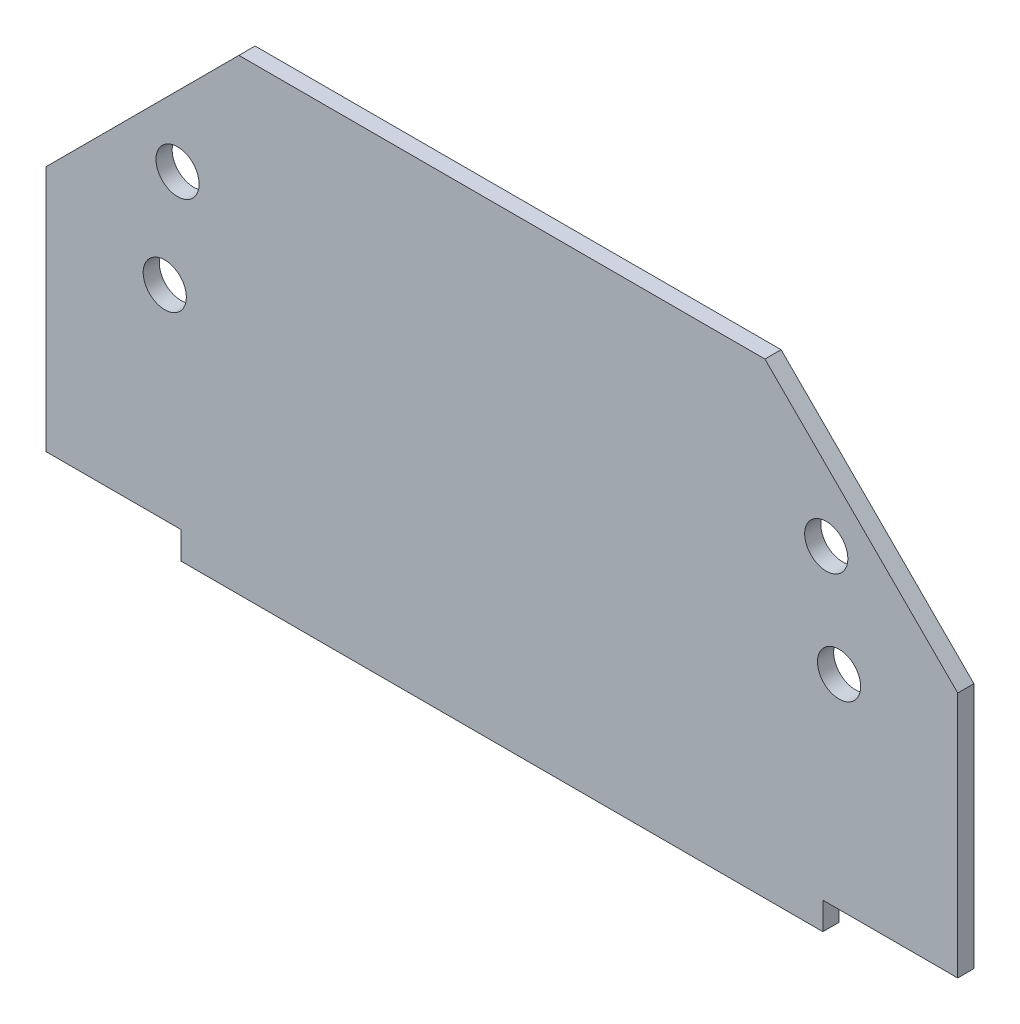
from build123d import *

# Parameters (mm, degrees)
SKETCH1_R           = 1.6
BOSS_EXTRUDE1_DEPTH = 1.2


with BuildPart() as part:
    # Sketch1 → Boss-Extrude1 (new body)
    with BuildSketch(Plane.XY):
        Polygon((-33.8, 12.786782193), (-33.8, 31.089725919), (-19.502943725, 45.386782193), (19.502943725, 45.386782193), (33.8, 31.089725919), (33.8, 12.786782193), (23.8, 12.786782193), (23.8, 10.758772246), (-23.8, 10.758772246), (-23.8, 12.786782193), align=None)
        with Locations((-25, 27.900566449)):
            Circle(SKETCH1_R, mode=Mode.SUBTRACT)
        with Locations((25, 27.900566449)):
            Circle(SKETCH1_R, mode=Mode.SUBTRACT)
        with Locations((-24.052480502, 35.639262695)):
            Circle(SKETCH1_R, mode=Mode.SUBTRACT)
        with Locations((24.052480502, 35.639262695)):
            Circle(SKETCH1_R, mode=Mode.SUBTRACT)
    extrude(amount=BOSS_EXTRUDE1_DEPTH)


solid = part.part
